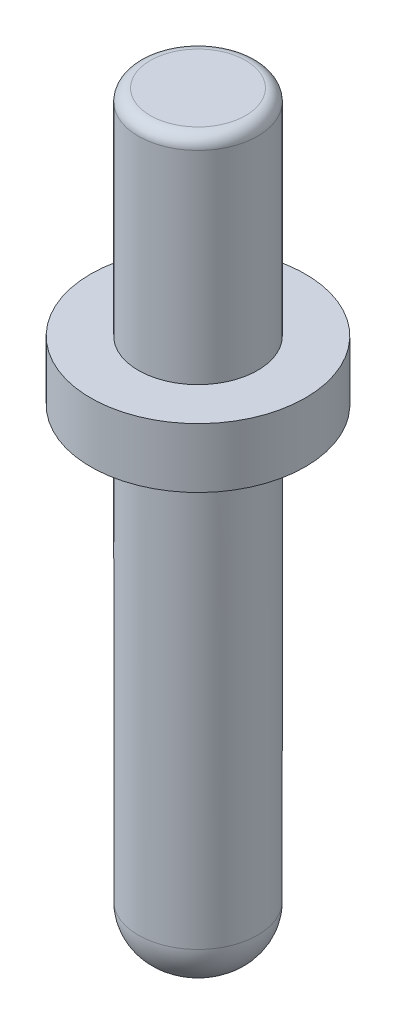
from build123d import *

# Parameters (mm, degrees)
FILLET_1_R = 0.1
FILLET_2_R = 0.4


with BuildPart() as part:
    # 草图1 → 旋转1 (revolve)
    with BuildSketch(Plane.XY):
        Polygon((0, -4), (-0.5, -4), (-0.5, 0), (-0.9, 0), (-0.9, 0.5), (-0.5, 0.5), (-0.5, 2.3), (0, 2.3), align=None)
    revolve(axis=Axis((0, 13.687242456, 0), (0, -1, 0)))

    # 圆角1
    fillet_1_edges = [part.edges().sort_by_distance(p)[0] for p in [
        (0.5, 2.3, 0),
    ]]
    fillet(fillet_1_edges, radius=FILLET_1_R)

    # 圆角2
    fillet_2_edges = [part.edges().sort_by_distance(p)[0] for p in [
        (0.5, -4, 0),
    ]]
    fillet(fillet_2_edges, radius=FILLET_2_R)


solid = part.part
